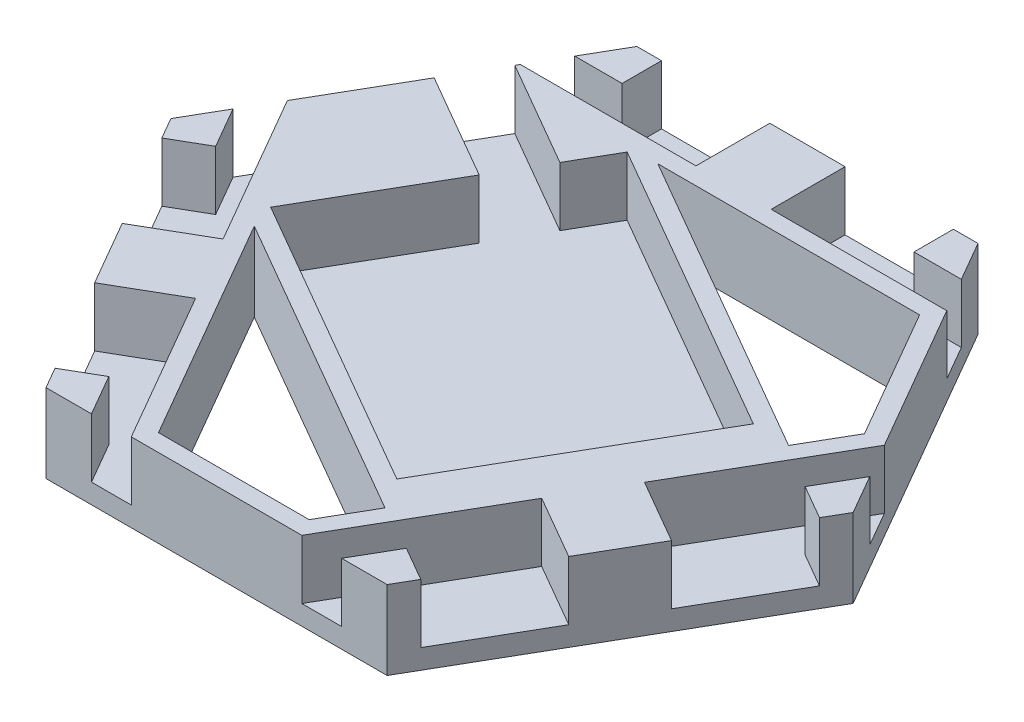
from build123d import *

# Parameters (mm, degrees)
BOSS_EXTRUDE1_DEPTH     = 16
SKETCH2_W               = 22
SKETCH2_H               = 15
CUT_EXTRUDE1_DEPTH      = 12
CUT_EXTRUDE2_DEPTH      = 94.037626797
CUT_EXTRUDE2_DEPTH_BACK = 12
CUT_EXTRUDE4_DEPTH      = 12
CUT_EXTRUDE5_DEPTH      = 94.037626797


with BuildPart() as part:
    # Sketch1 → Boss-Extrude1 (new body)
    with BuildSketch(Plane(origin=(0, 0, 0), x_dir=(1, 0, 0), z_dir=(0, 1, 0))):
        Polygon((69.282032303, 0), (34.641016151, 60), (-34.641016151, 60), (-69.282032303, 0), (-34.641016151, -60), (34.641016151, -60), align=None)
    extrude(amount=BOSS_EXTRUDE1_DEPTH)

    # Sketch2 → Cut-Extrude1 (cut)
    with BuildSketch(Plane(origin=(0, 16, 0), x_dir=(1, 0, 0), z_dir=(0, 1, 0))):
        with Locations((-18.641016151, 52.5)):
            Rectangle(SKETCH2_W, SKETCH2_H)
        with Locations((18.641016151, 52.5)):
            Rectangle(SKETCH2_W, SKETCH2_H)
        Polygon((66.782032303, -4.330127019), (53.791651246, 3.169872981), (42.791651246, -15.882685902), (55.782032303, -23.382685902), align=None)
        Polygon((48.141016151, -36.617314098), (35.150635095, -29.117314098), (24.150635095, -48.169872981), (37.141016151, -55.669872981), align=None)
        Polygon((-37.141016151, -55.669872981), (-24.150635095, -48.169872981), (-35.150635095, -29.117314098), (-48.141016151, -36.617314098), align=None)
        Polygon((-55.782032303, -23.382685902), (-42.791651246, -15.882685902), (-53.791651246, 3.169872981), (-66.782032303, -4.330127019), align=None)
    extrude(amount=-CUT_EXTRUDE1_DEPTH, mode=Mode.SUBTRACT)

    # Sketch3 → Cut-Extrude2 (cut, two sides: drawn at the far end of the back side and taken through both)
    with BuildSketch(Plane(origin=(0, 16, 0), x_dir=(1, 0, 0), z_dir=(0, 1, 0)).offset(-CUT_EXTRUDE2_DEPTH_BACK)):
        Polygon((-43.560889132, -5.4496732), (17.060889132, -40.4496732), (43.560889132, 5.4496732), (-17.060889132, 40.4496732), align=None)
        Polygon((-22.060889132, 31.789419162), (-28.060889132, 21.397114317), (-49.711524227, 33.897114317), (-43.711524227, 44.289419162), align=None)
    extrude(amount=CUT_EXTRUDE2_DEPTH + CUT_EXTRUDE2_DEPTH_BACK, mode=Mode.SUBTRACT)

    # Sketch4 → Cut-Extrude4 (cut)
    with BuildSketch(Plane(origin=(0, 16, 0), x_dir=(1, 0, 0), z_dir=(0, 1, 0))):
        Polygon((-53.791651246, 3.169872981), (-59.853829072, -0.330127019), (-64.663230149, 8), (-60.621778265, 15), align=None)
        Polygon((-24.150635095, -48.169872981), (-30.212812921, -51.669872981), (-25.403411844, -60), (-17.320508076, -60), align=None)
        Polygon((43.301270189, 45), (29.641016151, 45), (29.641016151, 52), (39.259818305, 52), align=None)
        Polygon((-43.301270189, 45), (-29.641016151, 45), (-29.641016151, 52), (-39.259818305, 52), align=None)
        Polygon((17.320508076, -60), (24.150635095, -48.169872981), (30.212812921, -51.669872981), (25.403411844, -60), align=None)
        Polygon((60.621778265, 15), (53.791651246, 3.169872981), (59.853829072, -0.330127019), (64.663230149, 8), align=None)
    extrude(amount=-CUT_EXTRUDE4_DEPTH, mode=Mode.SUBTRACT)

    # Sketch7 → Cut-Extrude5 (cut, through all)
    with BuildSketch(Plane(origin=(0, 16, 0), x_dir=(1, 0, 0), z_dir=(0, 1, 0))):
        Polygon((-41.880108514, -10.461524227), (-15.299782134, -56.5), (15.299782134, -56.5), (20.940054257, -46.730762114), align=None)
        Polygon((-11.880108514, 41.5), (50.940054257, 5.230762114), (56.580326381, 15), (41.280544247, 41.5), align=None)
    extrude(amount=-CUT_EXTRUDE5_DEPTH, mode=Mode.SUBTRACT)


solid = part.part
